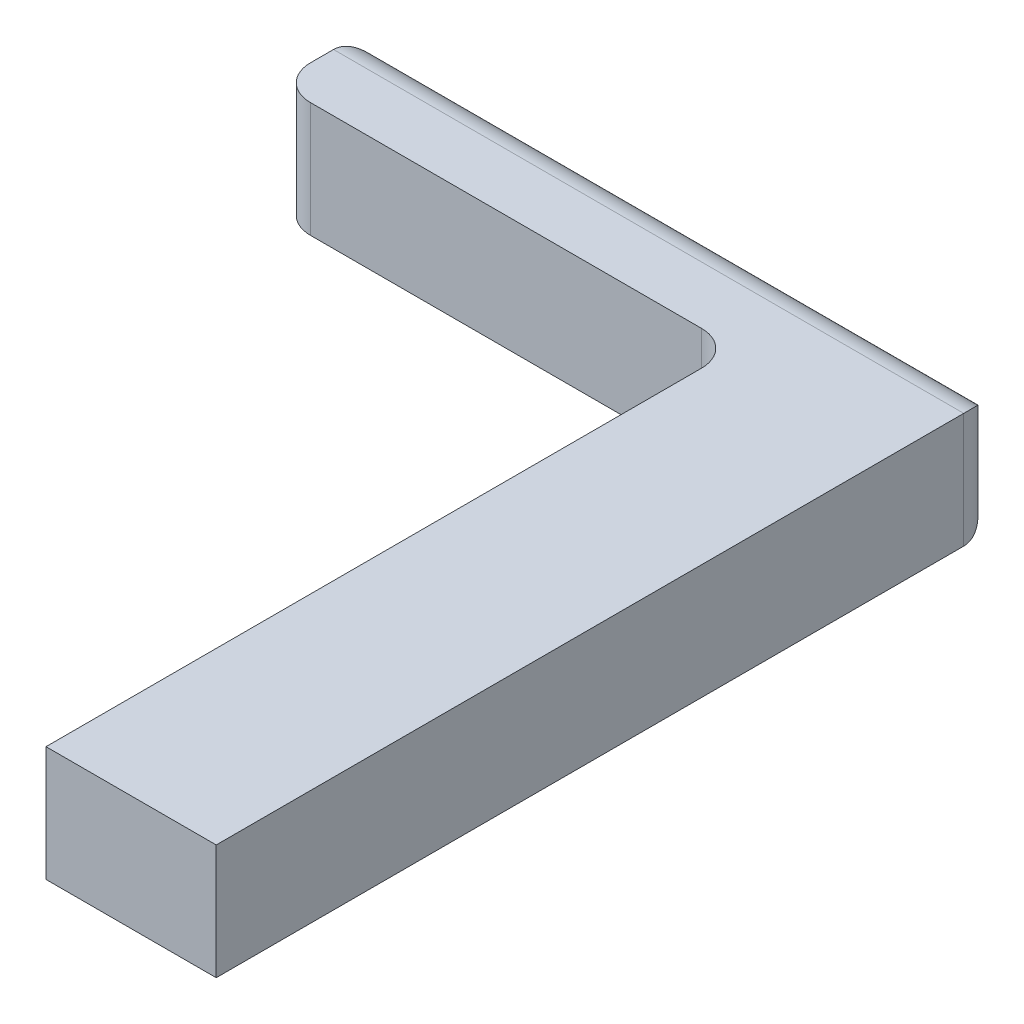
from build123d import *

# Parameters (mm, degrees)
SKETCH1_W           = 14.8
SKETCH1_H           = 68
BOSS_EXTRUDE1_DEPTH = 10
SKETCH2_W           = 8
SKETCH2_H           = 10
BOSS_EXTRUDE2_DEPTH = 40
FILLET2_R           = 3


with BuildPart() as part:
    # Sketch1 → Boss-Extrude1 (new body)
    with BuildSketch(Plane(origin=(0, 0, 0), x_dir=(1, 0, 0), z_dir=(0, 1, 0))):
        Rectangle(SKETCH1_W, SKETCH1_H)
    extrude(amount=BOSS_EXTRUDE1_DEPTH)

    # Sketch2 → Boss-Extrude2 (add)
    with BuildSketch(Plane.ZY.offset(7.4)):
        with Locations((-30, 5)):
            Rectangle(SKETCH2_W, SKETCH2_H)
    extrude(amount=BOSS_EXTRUDE2_DEPTH)

    # Fillet2
    fillet2_edges = [part.edges().sort_by_distance(p)[0] for p in [
        (-7.4, 5, -26),
        (-20, 10, -34),
        (-47.4, 5, -34),
        (-47.4, 5, -26),
        (-20, 0, -34),
        (7.4, 5, -34),
    ]]
    fillet(fillet2_edges, radius=FILLET2_R)


solid = part.part
